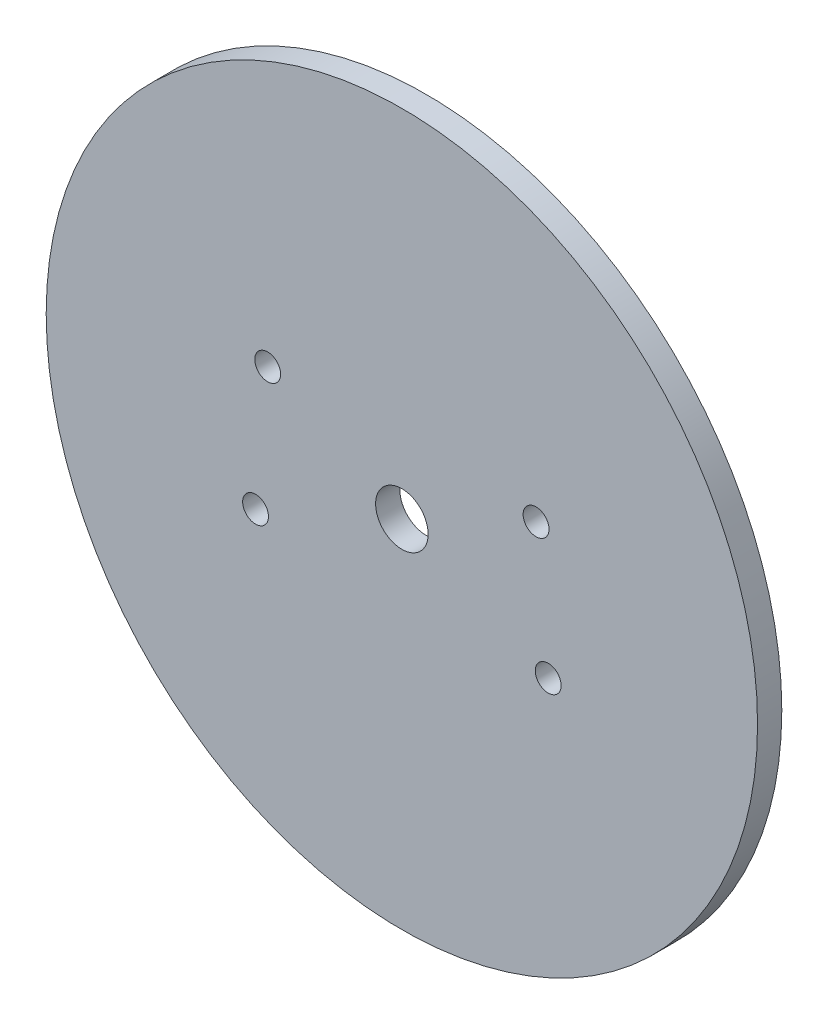
from build123d import *

# Parameters (mm, degrees)
SKETCH_1_R          = 44
EXTRUDE_1_DEPTH     = 3
SKETCH_2_R          = 1.6
CUT_EXTRUDE_1_DEPTH = 3
SKETCH_3_R          = 3.25
CUT_EXTRUDE_2_DEPTH = 35


with BuildPart() as part:
    # ｽｹｯﾁ1 → ﾎﾞｽ - 押し出し1 (new body)
    with BuildSketch(Plane.XY):
        Circle(SKETCH_1_R)
    extrude(amount=EXTRUDE_1_DEPTH)

    # ｽｹｯﾁ2 → ｶｯﾄ - 押し出し1 (cut)
    with BuildSketch(Plane.XY.offset(3)):
        with Locations((-16.6, 8)):
            Circle(SKETCH_2_R)
        with Locations((-18.1, -8)):
            Circle(SKETCH_2_R)
        with Locations(Location((18.1, -8, 0), (0, 0, 180))):
            Circle(SKETCH_2_R)
        with Locations(Location((16.6, 8, 0), (0, 0, 180))):
            Circle(SKETCH_2_R)
    extrude(amount=-CUT_EXTRUDE_1_DEPTH, mode=Mode.SUBTRACT)

    # ｽｹｯﾁ3 → ｶｯﾄ - 押し出し2 (cut)
    with BuildSketch(Plane.XY.offset(3)):
        Circle(SKETCH_3_R)
    extrude(amount=-CUT_EXTRUDE_2_DEPTH, mode=Mode.SUBTRACT)


solid = part.part
